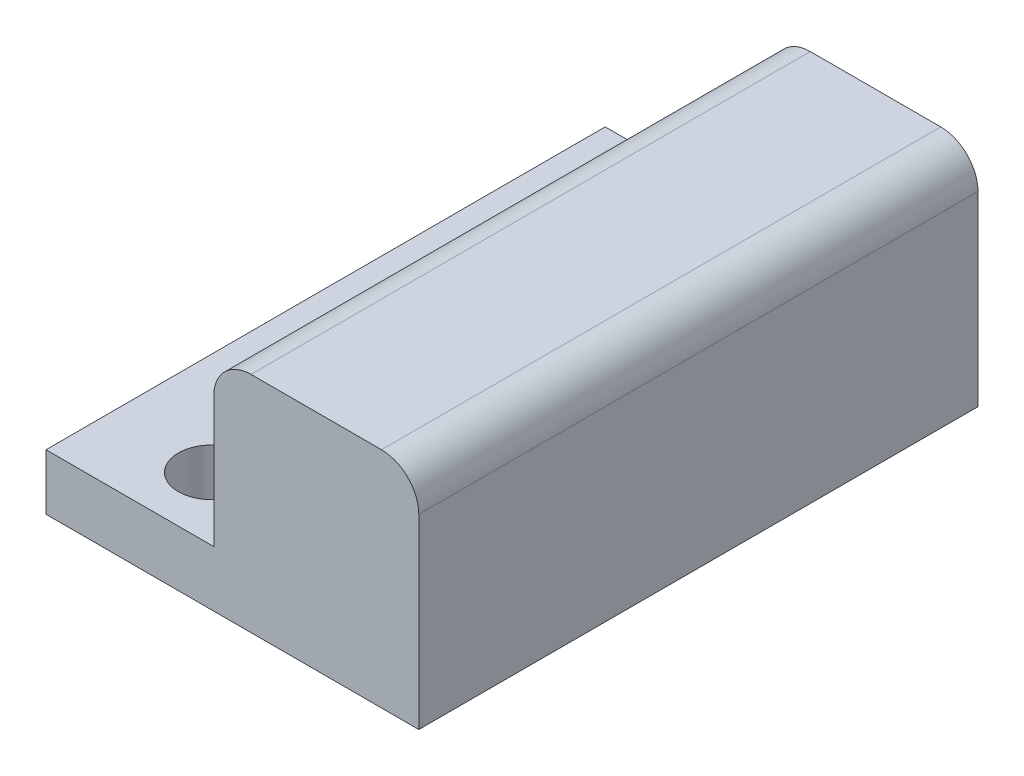
from build123d import *

# Parameters (mm, degrees)
SKETCH1_W           = 25.4
SKETCH1_H           = 38.1
SKETCH1_R           = 2.286
BOSS_EXTRUDE1_DEPTH = 3.81
BOSS_EXTRUDE2_DEPTH = 8.89
SKETCH3_W           = 13.97
SKETCH3_H           = 38.1
BOSS_EXTRUDE3_DEPTH = 2.54
CHAMFER1_SIZE       = 1.27
FILLET2_R           = 2.54


with BuildPart() as part:
    # Sketch1 → Boss-Extrude1 (new body)
    with BuildSketch(Plane(origin=(0, 0, 0), x_dir=(1, 0, 0), z_dir=(0, 1, 0))):
        with Locations((-7.278450326, -12.423109088)):
            Rectangle(SKETCH1_W, SKETCH1_H)
        with Locations(Location((1.611549674, 1.419890912, 0), (0, 0, 90))):
            Circle(SKETCH1_R, mode=Mode.SUBTRACT)
        with Locations(Location((-1.563450326, -27.155109088, 0), (0, 0, 90))):
            Circle(SKETCH1_R, mode=Mode.SUBTRACT)
    extrude(amount=BOSS_EXTRUDE1_DEPTH)

    # Sketch2 → Boss-Extrude2 (add)
    with BuildSketch(Plane(origin=(0, 3.81, 0), x_dir=(1, 0, 0), z_dir=(0, 1, 0))):
        Polygon((-19.978450326, 6.626890912), (-19.978450326, -31.473109088), (-6.008450326, -31.473109088), (-6.008450326, 6.626890912), (-8.548450326, 6.626890912), (-8.548450326, -28.933109088), (-17.438450326, -28.933109088), (-17.438450326, 6.626890912), align=None)
    extrude(amount=BOSS_EXTRUDE2_DEPTH)

    # Sketch3 → Boss-Extrude3 (add)
    with BuildSketch(Plane(origin=(0, 12.7, 0), x_dir=(1, 0, 0), z_dir=(0, 1, 0))):
        with Locations((-12.993450326, -12.423109088)):
            Rectangle(SKETCH3_W, SKETCH3_H)
    extrude(amount=BOSS_EXTRUDE3_DEPTH)

    # Chamfer1
    chamfer1_edges = [part.edges().sort_by_distance(p)[0] for p in [
        (-8.548450326, 12.7, 11.153109088),
        (-17.438450326, 12.7, 11.153109088),
    ]]
    chamfer(chamfer1_edges, length=CHAMFER1_SIZE)

    # Fillet2
    fillet2_edges = [part.edges().sort_by_distance(p)[0] for p in [
        (-19.978450326, 15.24, 12.423109088),
        (-6.008450326, 15.24, 12.423109088),
    ]]
    fillet(fillet2_edges, radius=FILLET2_R)


with BuildPart() as body_2:
    # Mirror1: mirrored copy
    add(part.part.mirror(Plane(origin=(5.421549674, 3.81, -6.626890912), x_dir=(0, 0, 1), z_dir=(-1, 0, 0))))


solid = body_2.part
